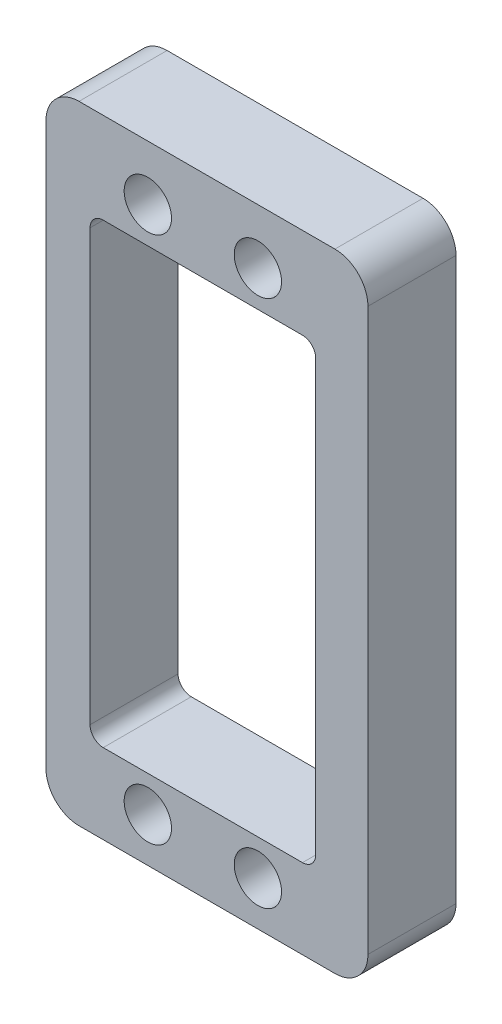
from build123d import *

# Parameters (mm, degrees)
SKETCH_1_W          = 100
SKETCH_1_H          = 100
EXTRUDE_1_DEPTH     = 8
SKETCH_2_R          = 2.15
CUT_EXTRUDE_1_DEPTH = 142.647449677
SKETCH_3_R          = 2.15
CUT_EXTRUDE_2_DEPTH = 142.647449677
SKETCH_4_R          = 2.15
CUT_EXTRUDE_3_DEPTH = 142.647449677
SKETCH_5_W          = 20.5
SKETCH_5_H          = 41.5
CUT_EXTRUDE_4_DEPTH = 10
SKETCH_6_W          = 55
SKETCH_6_H          = 100
CUT_EXTRUDE_5_DEPTH = 10
FILLET_2_R          = 1.2
SKETCH_8_R          = 1.65
CUT_EXTRUDE_6_DEPTH = 142.647449677
SKETCH_9_W          = 15.75
SKETCH_9_H          = 78.5
CUT_EXTRUDE_7_DEPTH = 142.647449677
FILLET_3_R          = 10
FILLET_4_R          = 3
SKETCH_10_R         = 1.65
SKETCH_10_R_2       = 2.15
CUT_EXTRUDE_8_DEPTH = 142.647449677
FILLET_5_R          = 3


with BuildPart() as part:
    # 草图1 → 凸台-拉伸1 (new body)
    with BuildSketch(Plane.XY):
        with Locations((50, -50)):
            Rectangle(SKETCH_1_W, SKETCH_1_H)
    extrude(amount=EXTRUDE_1_DEPTH)

    # 草图2 → 切除-拉伸1 (cut, through all)
    with BuildSketch(Plane.XY.offset(8)):
        with Locations((80, -53)):
            Circle(SKETCH_2_R)
        with Locations((90, -53)):
            Circle(SKETCH_2_R)
        with Locations((90, -5)):
            Circle(SKETCH_2_R)
        with Locations((80, -5)):
            Circle(SKETCH_2_R)
    extrude(amount=-CUT_EXTRUDE_1_DEPTH, mode=Mode.SUBTRACT)

    # 草图3 → 切除-拉伸2 (cut, through all)
    with BuildSketch(Plane.XY.offset(8)):
        with Locations((73, -95)):
            Circle(SKETCH_3_R)
        with Locations((73, -85)):
            Circle(SKETCH_3_R)
        with Locations((85, -85)):
            Circle(SKETCH_3_R)
        with Locations((85, -95)):
            Circle(SKETCH_3_R)
    extrude(amount=-CUT_EXTRUDE_2_DEPTH, mode=Mode.SUBTRACT)

    # 草图4 → 切除-拉伸3 (cut, through all)
    with BuildSketch(Plane.XY.offset(8)):
        with BuildLine():
            ThreePointArc((81, -100), (71.5, -90.5), (62, -100))
            Line((62, -100), (81, -100))
        make_face()
        with Locations((73, -95)):
            Circle(SKETCH_4_R, mode=Mode.SUBTRACT)
    extrude(amount=-CUT_EXTRUDE_3_DEPTH, mode=Mode.SUBTRACT)

    # 草图5 → 切除-拉伸4 (cut)
    with BuildSketch(Plane.XY.offset(8)):
        with Locations((85, -29)):
            Rectangle(SKETCH_5_W, SKETCH_5_H)
    extrude(amount=-CUT_EXTRUDE_4_DEPTH, mode=Mode.SUBTRACT)

    # 草图6 → 切除-拉伸5 (cut)
    with BuildSketch(Plane.XY.offset(8)):
        with Locations((27.5, -50)):
            Rectangle(SKETCH_6_W, SKETCH_6_H)
    extrude(amount=-CUT_EXTRUDE_5_DEPTH, mode=Mode.SUBTRACT)

    # 圆角2
    fillet_2_edges = [part.edges().sort_by_distance(p)[0] for p in [
        (95.25, -49.75, 4),
        (74.75, -49.75, 4),
        (74.75, -8.25, 4),
        (95.25, -8.25, 4),
    ]]
    fillet(fillet_2_edges, radius=FILLET_2_R)

    # 草图8 → 切除-拉伸6 (cut, through all)
    with BuildSketch(Plane.XY.offset(8)):
        with Locations((59, -84)):
            Circle(SKETCH_8_R)
    extrude(amount=-CUT_EXTRUDE_6_DEPTH, mode=Mode.SUBTRACT)

    # 草图9 → 切除-拉伸7 (cut, through all)
    with BuildSketch(Plane.XY.offset(8)):
        with BuildLine():
            Line((71.5, -90.5), (55, -90.5))
            Line((55, -90.5), (55, -100))
            Line((55, -100), (62, -100))
            ThreePointArc((62, -100), (64.782485579, -93.282485579), (71.5, -90.5))
        make_face()
        with Locations((62.875, -39.25)):
            Rectangle(SKETCH_9_W, SKETCH_9_H)
    extrude(amount=-CUT_EXTRUDE_7_DEPTH, mode=Mode.SUBTRACT)

    # 圆角3
    fillet_3_edges = [part.edges().sort_by_distance(p)[0] for p in [
        (70.75, -78.5, 4),
    ]]
    fillet(fillet_3_edges, radius=FILLET_3_R)

    # 圆角4
    fillet_4_edges = [part.edges().sort_by_distance(p)[0] for p in [
        (55, -90.5, 4),
        (55, -78.5, 4),
        (70.75, 0, 4),
        (81, -100, 4),
        (100, 0, 4),
        (100, -100, 4),
    ]]
    fillet(fillet_4_edges, radius=FILLET_4_R)

    # 草图10 → 切除-拉伸8 (cut, through all)
    with BuildSketch(Plane.XY.offset(8)):
        with BuildLine():
            Line((100, -57), (70.75, -57))
            Line((70.75, -57), (70.75, -68.5))
            ThreePointArc((70.75, -68.5), (67.821067812, -75.571067812), (60.75, -78.5))
            Line((60.75, -78.5), (58, -78.5))
            ThreePointArc((58, -78.5), (55.878679656, -79.378679656), (55, -81.5))
            Line((55, -81.5), (55, -87.5))
            ThreePointArc((55, -87.5), (55.878679656, -89.621320344), (58, -90.5))
            Line((58, -90.5), (71.5, -90.5))
            ThreePointArc((71.5, -90.5), (77.356193303, -92.51969252), (80.722342436, -97.72))
            ThreePointArc((80.722342436, -97.72), (81.785336899, -99.362202362), (83.6346611, -100))
            Line((83.6346611, -100), (97, -100))
            ThreePointArc((97, -100), (99.121320344, -99.121320344), (100, -97))
            Line((100, -97), (100, -57))
        make_face()
        with Locations((59, -84)):
            Circle(SKETCH_10_R, mode=Mode.SUBTRACT)
        with Locations((73, -85)):
            Circle(SKETCH_10_R_2, mode=Mode.SUBTRACT)
        with Locations((85, -95)):
            Circle(SKETCH_10_R_2, mode=Mode.SUBTRACT)
        with Locations((85, -85)):
            Circle(SKETCH_10_R_2, mode=Mode.SUBTRACT)
    extrude(amount=-CUT_EXTRUDE_8_DEPTH, mode=Mode.SUBTRACT)

    # 圆角5
    fillet_5_edges = [part.edges().sort_by_distance(p)[0] for p in [
        (70.75, -57, 4),
        (100, -57, 4),
    ]]
    fillet(fillet_5_edges, radius=FILLET_5_R)


solid = part.part
